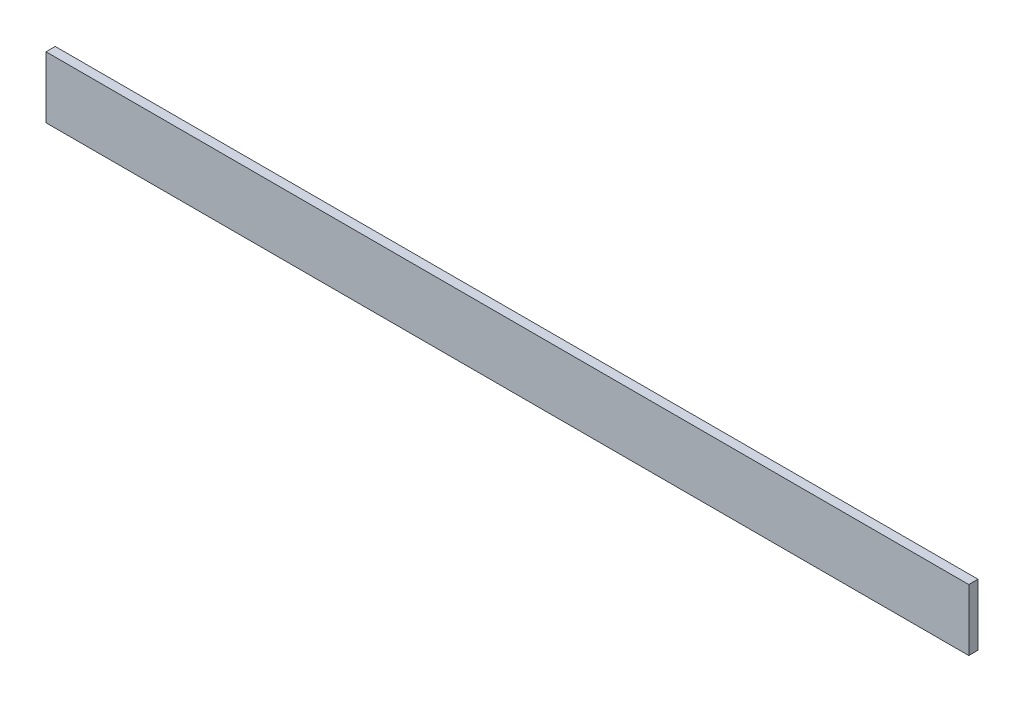
from build123d import *

# Parameters (mm, degrees)
SKETCH1_W           = 300
SKETCH1_H           = 20
BOSS_EXTRUDE1_DEPTH = 3


with BuildPart() as part:
    # Sketch1 → Boss-Extrude1 (new body)
    with BuildSketch(Plane.XY):
        Rectangle(SKETCH1_W, SKETCH1_H)
    extrude(amount=BOSS_EXTRUDE1_DEPTH)


solid = part.part
